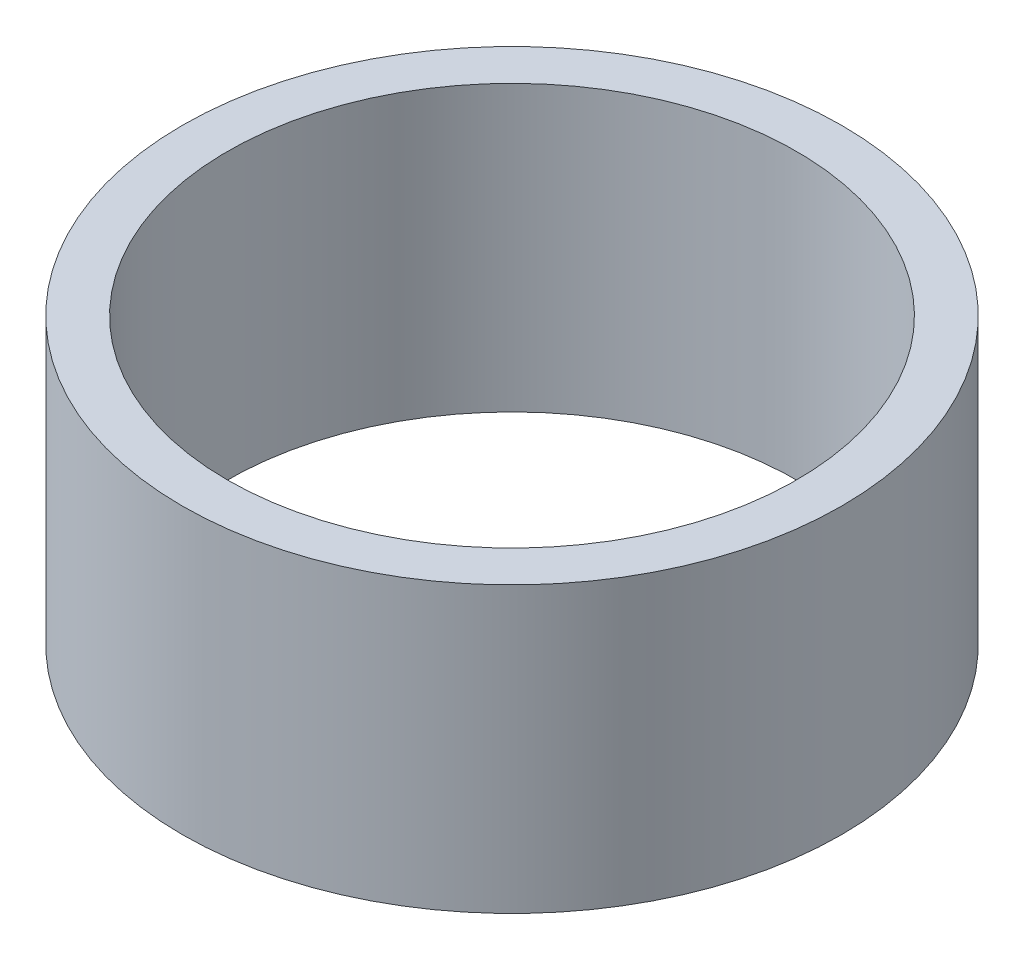
from build123d import *

# Parameters (mm, degrees)
SKETCH1_R           = 4.75
SKETCH1_R_2         = 4.1
BOSS_EXTRUDE1_DEPTH = 4.1


with BuildPart() as part:
    # Sketch1 → Boss-Extrude1 (new body)
    with BuildSketch(Plane(origin=(0, 0, 0), x_dir=(1, 0, 0), z_dir=(0, 1, 0))):
        with Locations(Location((0, 0, 0), (0, 0, 270))):
            Circle(SKETCH1_R)
        with Locations(Location((0, 0, 0), (0, 0, 270))):
            Circle(SKETCH1_R_2, mode=Mode.SUBTRACT)
    extrude(amount=BOSS_EXTRUDE1_DEPTH)


solid = part.part
